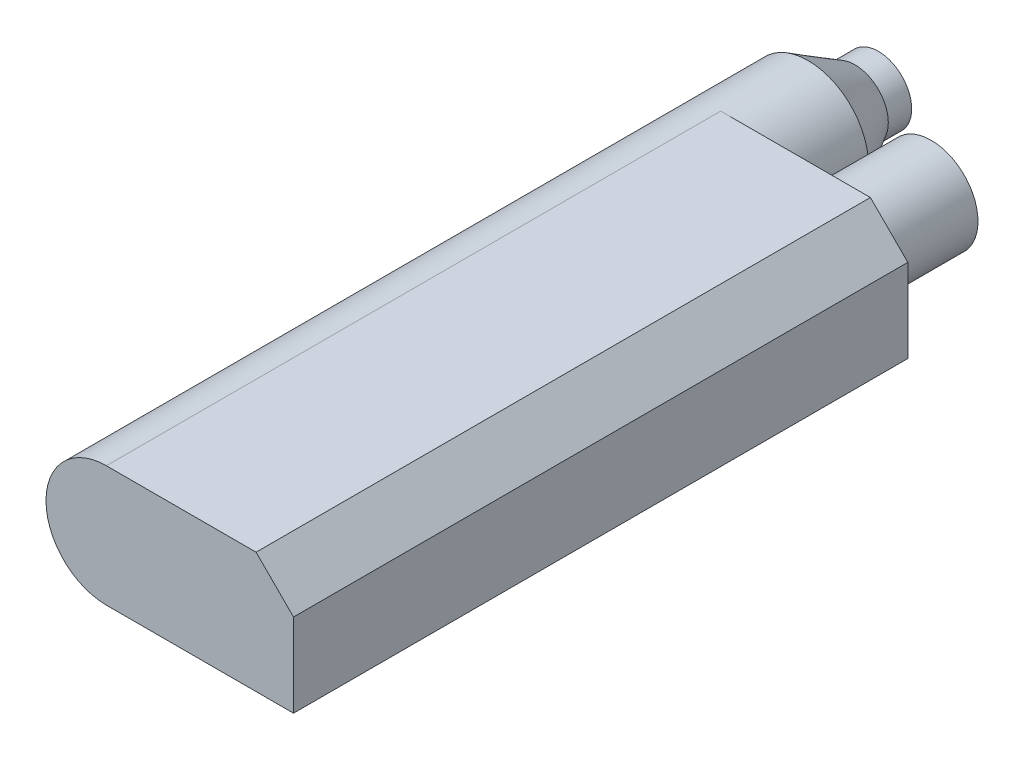
from build123d import *

# Parameters (mm, degrees)
SKETCH1_R           = 713.105
BOSS_EXTRUDE1_DEPTH = 500
SKETCH2_R           = 713.105
BOSS_EXTRUDE3_DEPTH = 1000
BOSS_EXTRUDE3_DRAFT = -30
SKETCH3_R           = 1290.45526919
BOSS_EXTRUDE4_DEPTH = 15000
SKETCH5_W           = 13130.287461106
SKETCH5_H           = 2580.91053838
BOSS_EXTRUDE5_DEPTH = 4000
SKETCH6_R           = 1000
BOSS_EXTRUDE6_DEPTH = 2000
CHAMFER1_SIZE       = 800


with BuildPart() as part:
    # Sketch1 → Boss-Extrude1 (new body)
    with BuildSketch(Plane.XY):
        Circle(SKETCH1_R)
    extrude(amount=BOSS_EXTRUDE1_DEPTH)


with BuildPart() as boss_extrude3_tool:
    # Sketch2 → Boss-Extrude3 (with draft: the straight prism first)
    with BuildSketch(Plane.XY.offset(500)):
        Circle(SKETCH2_R)
    extrude(amount=BOSS_EXTRUDE3_DEPTH)
    # Boss-Extrude3: the draft: its side faces are tilted about the plane it starts from
    boss_extrude3_sides = [boss_extrude3_tool.faces().sort_by_distance(p)[0] for p in [
        (-713.105, 0, 1000),
    ]]
    draft(boss_extrude3_sides, Plane.XY.offset(500), BOSS_EXTRUDE3_DRAFT)


with BuildPart() as part_1:
    add(part.part)

    # Boss-Extrude3: add boss_extrude3_tool
    add(boss_extrude3_tool.part)

    # Sketch3 → Boss-Extrude4 (add)
    with BuildSketch(Plane.XY.offset(1500)):
        Circle(SKETCH3_R)
    extrude(amount=BOSS_EXTRUDE4_DEPTH)

    # Sketch5 → Boss-Extrude5 (add)
    with BuildSketch(Plane(origin=(0, 0, 0), x_dir=(0, 0, -1), z_dir=(1, 0, 0))):
        with Locations((-9934.856269447, 0)):
            Rectangle(SKETCH5_W, SKETCH5_H)
    extrude(amount=BOSS_EXTRUDE5_DEPTH)

    # Sketch6 → Boss-Extrude6 (add)
    with BuildSketch(Plane(origin=(0, 0, 3369.712538894), x_dir=(-1, 0, 0), z_dir=(0, 0, -1))):
        with Locations(Location((-2500, 0, 0), (0, 0, 180))):
            Circle(SKETCH6_R)
    extrude(amount=BOSS_EXTRUDE6_DEPTH)

    # Chamfer1
    chamfer1_edges = [part_1.edges().sort_by_distance(p)[0] for p in [
        (4000, 1290.45526919, 9934.856269447),
    ]]
    chamfer(chamfer1_edges, length=CHAMFER1_SIZE)


solid = part_1.part
